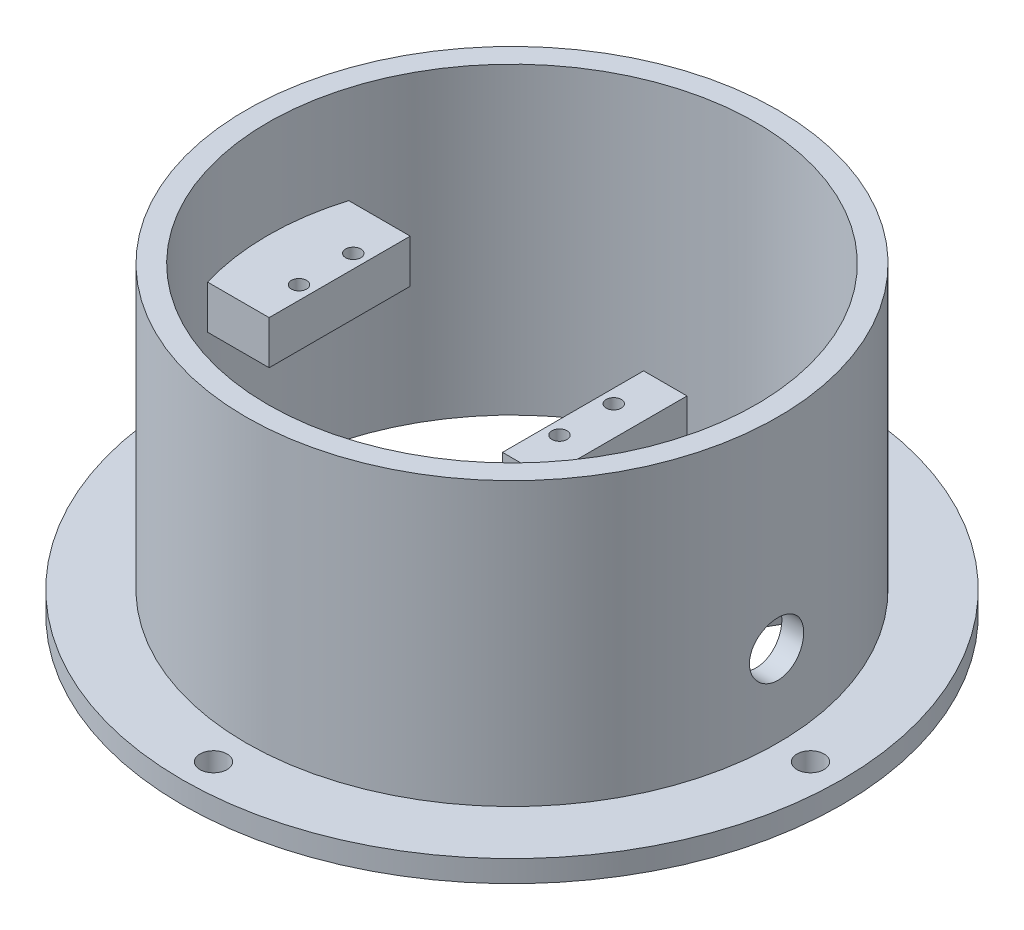
from build123d import *

# Parameters (mm, degrees)
SKETCH1_R               = 60.75
SKETCH1_R_2             = 45
BOSS_EXTRUDE1_DEPTH     = 4
SKETCH2_R               = 49
SKETCH2_R_2             = 45
BOSS_EXTRUDE2_DEPTH     = 52
SKETCH3_W               = 8
SKETCH3_H               = 38
SKETCH3_W_2             = 15
SKETCH3_H_2             = 8
BOSS_EXTRUDE3_DEPTH     = 13
SKETCH4_W               = 10
SKETCH4_H               = 23
CUT_EXTRUDE1_DEPTH      = 8
CUT_EXTRUDE2_REACH      = 111.593
CUT_EXTRUDE2_END_RADIUS = 49
SKETCH5_R               = 5
SKETCH6_R               = 1.4
CUT_EXTRUDE3_DEPTH      = 7.2
BOSS_EXTRUDE4_DEPTH     = 4
SKETCH8_R               = 2.5
CUT_EXTRUDE4_DEPTH      = 4


with BuildPart() as part:
    # Sketch1 → Boss-Extrude1 (new body)
    with BuildSketch(Plane(origin=(0, 0, 0), x_dir=(1, 0, 0), z_dir=(0, 1, 0))):
        with Locations(Location((0, 0, 0), (0, 0, 270))):
            Circle(SKETCH1_R)
        with Locations(Location((0, 0, 0), (0, 0, 270))):
            Circle(SKETCH1_R_2, mode=Mode.SUBTRACT)
    extrude(amount=BOSS_EXTRUDE1_DEPTH)

    # Sketch2 → Boss-Extrude2 (add)
    with BuildSketch(Plane(origin=(0, 4, 0), x_dir=(1, 0, 0), z_dir=(0, 1, 0))):
        with Locations(Location((0, 0, 0), (0, 0, 90))):
            Circle(SKETCH2_R)
        with Locations(Location((0, 0, 0), (0, 0, 270))):
            Circle(SKETCH2_R_2, mode=Mode.SUBTRACT)
    extrude(amount=BOSS_EXTRUDE2_DEPTH)

    # Sketch3 → Boss-Extrude3 (add, symmetric)
    with BuildSketch(Plane.XY):
        with Locations((15.25, 19)):
            Rectangle(SKETCH3_W, SKETCH3_H)
        with Locations((-39.25, 34)):
            Rectangle(SKETCH3_W_2, SKETCH3_H_2)
    extrude(amount=BOSS_EXTRUDE3_DEPTH, both=True)


with BuildPart() as boss_extrude3_piece_1:
    # of the separate pieces the step leaves, piece 1, a body of its own (boss_extrude3_pieces)
    add(part.part.solids().sort_by_distance((0, 0, 60.75))[0])

    # Cut-Extrude2: up to this cylinder (the profile starts inside it)
    cut_extrude2_end = Plane(origin=(0, 19, 0), z_dir=(0, -1, 0)) * Cylinder(CUT_EXTRUDE2_END_RADIUS, 322.186, mode=Mode.PRIVATE)
    # Sketch5 → Cut-Extrude2 (cut, up to the surface)
    with BuildSketch(Plane.ZY.offset(-11.25), mode=Mode.PRIVATE) as cut_extrude2_sk1:
        with Locations(Location((0, 19, 0), (0, 0, 270))):
            Circle(SKETCH5_R)
    cut_extrude2_tool1 = extrude(cut_extrude2_sk1.sketch, amount=-CUT_EXTRUDE2_REACH, mode=Mode.PRIVATE) & cut_extrude2_end
    add(cut_extrude2_tool1.solids().sort_by_distance((11.25, 19, 0))[0], mode=Mode.SUBTRACT)


with BuildPart() as boss_extrude3_piece_2:
    # of the separate pieces the step leaves, piece 2, a body of its own (boss_extrude3_pieces)
    add(part.part.solids().sort_by_distance((11.25, 0, -13))[0])

    # Sketch4 → Cut-Extrude1 (cut)
    with BuildSketch(Plane.ZY.offset(-11.25)):
        with Locations((0, 16.5)):
            Rectangle(SKETCH4_W, SKETCH4_H)
    extrude(amount=-CUT_EXTRUDE1_DEPTH, mode=Mode.SUBTRACT)


with BuildPart() as cut_extrude3_tool:
    # Sketch6 → Cut-Extrude3 (new body)
    with BuildSketch(Plane(origin=(0, 38, 0), x_dir=(1, 0, 0), z_dir=(0, 1, 0))):
        with Locations(Location((-34.25, -5, 0), (0, 0, 270))):
            Circle(SKETCH6_R)
        with Locations(Location((13.75, -5, 0), (0, 0, 270))):
            Circle(SKETCH6_R)
        with Locations(Location((13.75, 5, 0), (0, 0, 90))):
            Circle(SKETCH6_R)
        with Locations(Location((-34.25, 5, 0), (0, 0, 90))):
            Circle(SKETCH6_R)
    extrude(amount=-CUT_EXTRUDE3_DEPTH)


with BuildPart() as boss_extrude3_piece_1_1:
    add(boss_extrude3_piece_1.part)

    # Cut-Extrude3: cut by cut_extrude3_tool
    add(cut_extrude3_tool.part, mode=Mode.SUBTRACT)



with BuildPart() as boss_extrude3_piece_2_1:
    add(boss_extrude3_piece_2.part)

    # Cut-Extrude3: cut by cut_extrude3_tool
    add(cut_extrude3_tool.part, mode=Mode.SUBTRACT)


with BuildPart() as boss_extrude3_piece_1_2:
    add(boss_extrude3_piece_1_1.part)

    add(boss_extrude3_piece_2_1.part)  # Boss-Extrude4 merges Boss-Extrude3 piece 2
    # Sketch7 → Boss-Extrude4 (add)
    with BuildSketch(Plane.XZ):
        with BuildLine():
            Line((11.25, -13), (25.249838503, -37.248431585))
            ThreePointArc((25.249838503, -37.248431585), (45, 0), (25.249838503, 37.248431585))
            Line((25.249838503, 37.248431585), (11.25, 13))
            Line((11.25, 13), (11.25, -13))
        make_face()
        with BuildLine():
            Line((24.25, 19.516660498), (27.361802413, 24.906460381))
            ThreePointArc((27.361802413, 24.906460381), (37, 0), (27.361802413, -24.906460381))
            Line((27.361802413, -24.906460381), (24.25, -19.516660498))
            Line((24.25, -19.516660498), (24.25, 19.516660498))
        make_face(mode=Mode.SUBTRACT)
    extrude(amount=-BOSS_EXTRUDE4_DEPTH)

    # Sketch8 → Cut-Extrude4 (cut)
    with BuildSketch(Plane(origin=(0, 4, 0), x_dir=(1, 0, 0), z_dir=(0, 1, 0))):
        with Locations(Location((-55, 0, 0), (0, 0, 270))):
            Circle(SKETCH8_R)
        with Locations(Location((0, 55, 0), (0, 0, 270))):
            Circle(SKETCH8_R)
        with Locations(Location((55, 0, 0), (0, 0, 270))):
            Circle(SKETCH8_R)
        with Locations(Location((0, -55, 0), (0, 0, 270))):
            Circle(SKETCH8_R)
    extrude(amount=-CUT_EXTRUDE4_DEPTH, mode=Mode.SUBTRACT)


solid = boss_extrude3_piece_1_2.part
